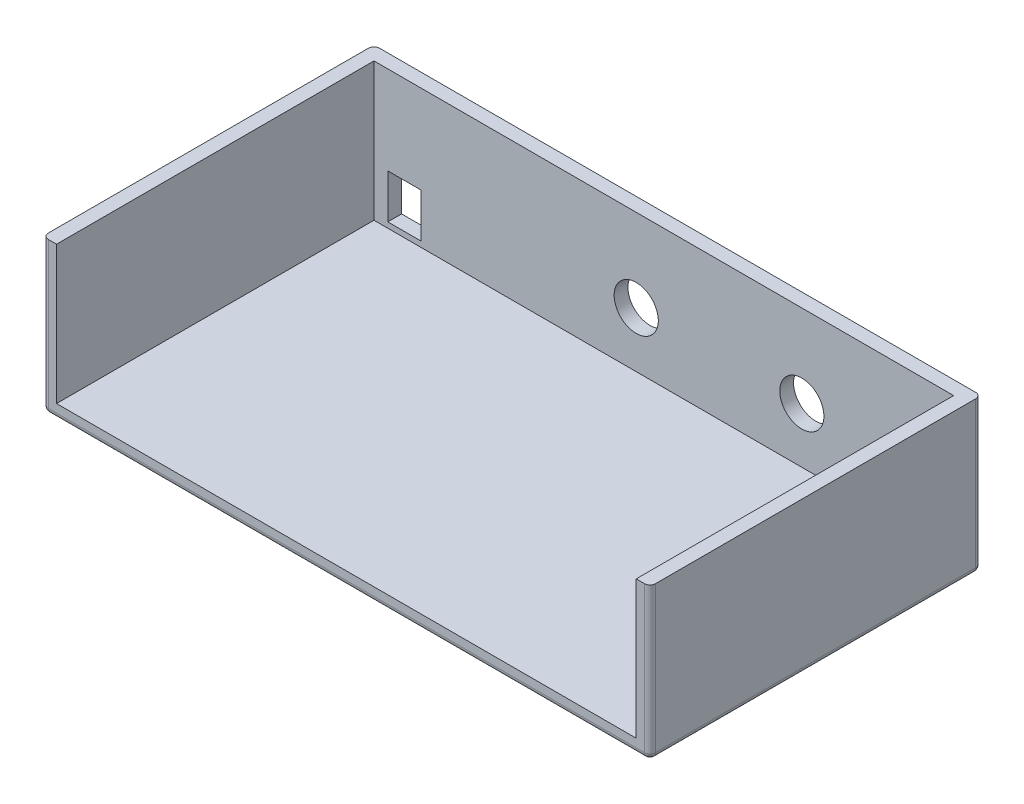
from build123d import *

# Parameters (mm, degrees)
CROQUIS1_W              = 220
CROQUIS1_H              = 120
SALIENTE_EXTRUIR1_DEPTH = 5
SALIENTE_EXTRUIR2_DEPTH = 50
CORTAR_EXTRUIR1_REACH   = 173.828
CROQUIS3_R              = 8
CROQUIS3_R_2            = 3.5
CROQUIS3_W              = 12
CROQUIS3_H              = 16
REDONDEO1_R             = 2


with BuildPart() as part:
    # Croquis1 → Saliente-Extruir1 (new body)
    with BuildSketch(Plane(origin=(0, 0, 0), x_dir=(1, 0, 0), z_dir=(0, 1, 0))):
        Rectangle(CROQUIS1_W, CROQUIS1_H)
    extrude(amount=SALIENTE_EXTRUIR1_DEPTH)

    # Croquis2 → Saliente-Extruir2 (add)
    with BuildSketch(Plane(origin=(0, 5, 0), x_dir=(1, 0, 0), z_dir=(0, 1, 0))):
        Polygon((-110, 60), (-105, 60), (105, 60), (110, 60), (110, -60), (105, -60), (105, 55), (-105, 55), (-105, -60), (-110, -60), align=None)
    extrude(amount=SALIENTE_EXTRUIR2_DEPTH)

    # Croquis3 → Cortar-Extruir1 (cut, up to next)
    with BuildSketch(Plane(origin=(0, 0, -60), x_dir=(-1, 0, 0), z_dir=(0, 0, -1)), mode=Mode.PRIVATE) as cortar_extruir1_sk1:
        with Locations((-50, 25)):
            Circle(CROQUIS3_R)
    cortar_extruir1_tool1 = extrude(cortar_extruir1_sk1.sketch, amount=-CORTAR_EXTRUIR1_REACH, mode=Mode.PRIVATE) & part.part
    # Croquis3 → Cortar-Extruir1 (cut, up to next)
    with BuildSketch(Plane(origin=(0, 0, -60), x_dir=(-1, 0, 0), z_dir=(0, 0, -1)), mode=Mode.PRIVATE) as cortar_extruir1_sk2:
        with Locations((10, 25)):
            Circle(CROQUIS3_R)
    cortar_extruir1_tool2 = extrude(cortar_extruir1_sk2.sketch, amount=-CORTAR_EXTRUIR1_REACH, mode=Mode.PRIVATE) & part.part
    # Croquis3 → Cortar-Extruir1 (cut, up to next)
    with BuildSketch(Plane(origin=(0, 0, -60), x_dir=(-1, 0, 0), z_dir=(0, 0, -1)), mode=Mode.PRIVATE) as cortar_extruir1_sk3:
        with Locations((-90, 25)):
            Circle(CROQUIS3_R_2)
    cortar_extruir1_tool3 = extrude(cortar_extruir1_sk3.sketch, amount=-CORTAR_EXTRUIR1_REACH, mode=Mode.PRIVATE) & part.part
    # Croquis3 → Cortar-Extruir1 (cut, up to next)
    with BuildSketch(Plane(origin=(0, 0, -60), x_dir=(-1, 0, 0), z_dir=(0, 0, -1)), mode=Mode.PRIVATE) as cortar_extruir1_sk4:
        with Locations((94, 15)):
            Rectangle(CROQUIS3_W, CROQUIS3_H)
    cortar_extruir1_tool4 = extrude(cortar_extruir1_sk4.sketch, amount=-CORTAR_EXTRUIR1_REACH, mode=Mode.PRIVATE) & part.part
    add(cortar_extruir1_tool1.solids().sort_by_distance((50, 25, -60))[0], mode=Mode.SUBTRACT)
    add(cortar_extruir1_tool2.solids().sort_by_distance((-10, 25, -60))[0], mode=Mode.SUBTRACT)
    add(cortar_extruir1_tool3.solids().sort_by_distance((90, 25, -60))[0], mode=Mode.SUBTRACT)
    add(cortar_extruir1_tool4.solids().sort_by_distance((-94, 15, -60))[0], mode=Mode.SUBTRACT)

    # Redondeo1
    redondeo1_edges = [part.edges().sort_by_distance(p)[0] for p in [
        (-110, 0, 0),
        (0, 0, 60),
        (110, 0, 0),
        (0, 0, -60),
        (-110, 27.5, -60),
        (-110, 27.5, 60),
        (110, 27.5, 60),
        (110, 27.5, -60),
    ]]
    fillet(redondeo1_edges, radius=REDONDEO1_R)


solid = part.part
